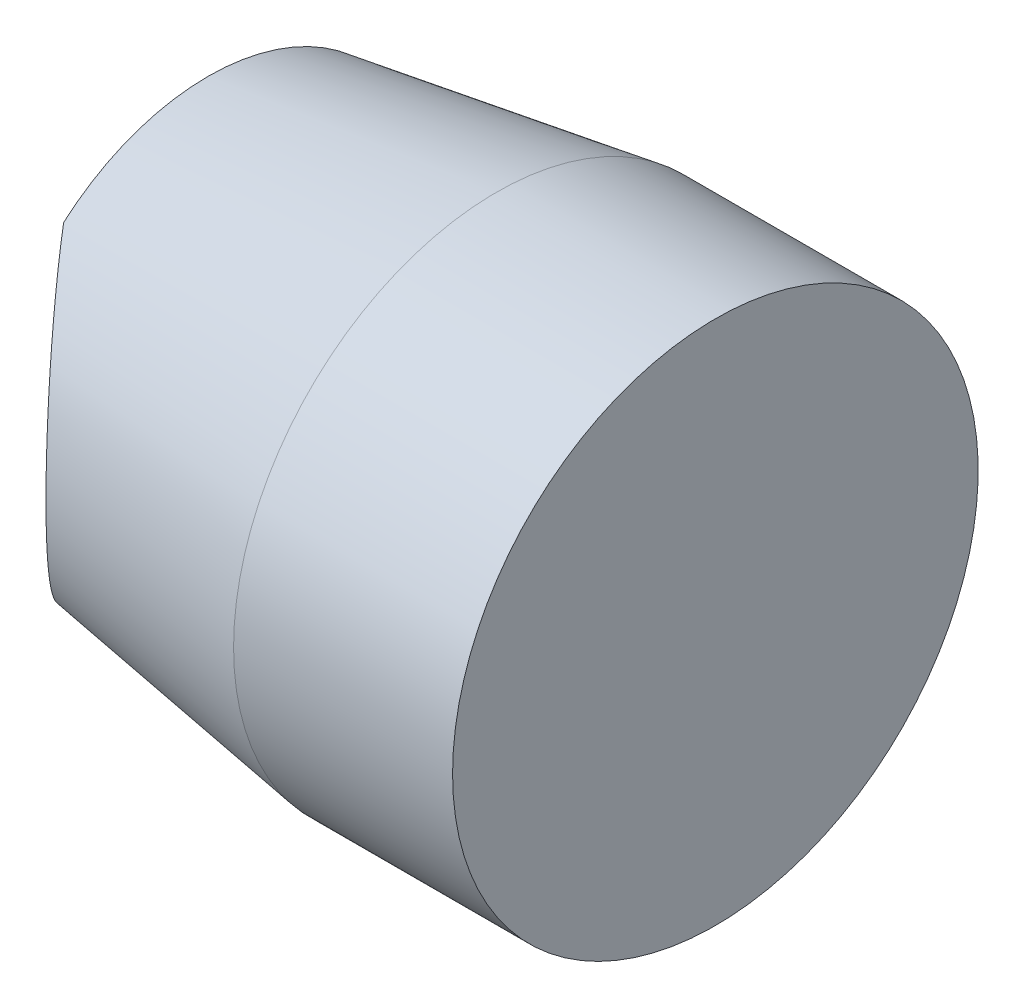
from build123d import *

# Parameters (mm, degrees)
CROQUIS2_R = 3.05


with BuildPart() as part:
    # Croquis1 → Revolución1 (revolve)
    with BuildSketch(Plane.XY, mode=Mode.PRIVATE) as revoluci_n1_sk:
        Polygon((0, 0), (6.95, 0), (6.95, 3.6), (3.95, 3.6), (0, 3), align=None)
    revolve(revoluci_n1_sk.sketch.rotate(Axis((0, 0, 0), (1, 0, 0)), 90), axis=Axis((0, 0, 0), (1, 0, 0)))

    # Croquis2 → Cortar-Revolución1 (revolve, cut)
    with BuildSketch(Plane.XY):
        with Locations((-2, 0)):
            Circle(CROQUIS2_R)
    revolve(axis=Axis((-37, 2.569103134, 0), (0, -1, 0)), mode=Mode.SUBTRACT)


solid = part.part
